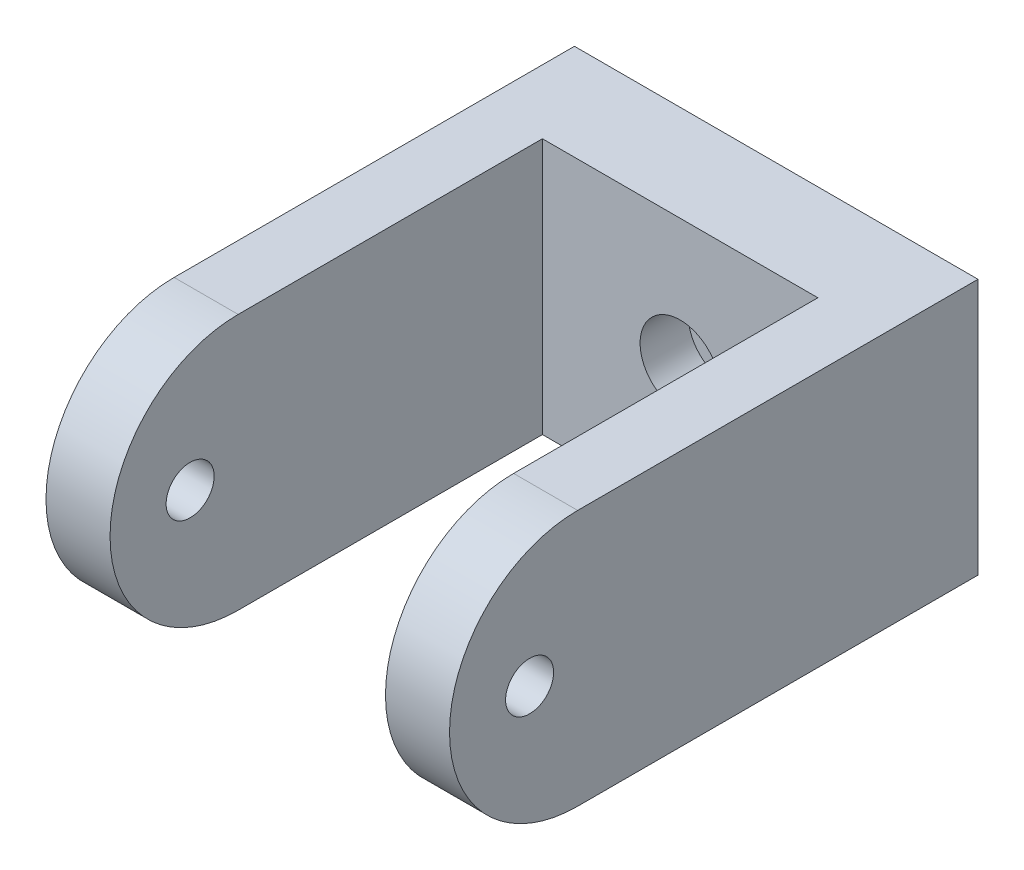
from build123d import *

# Parameters (mm, degrees)
IZIM1_W                     = 25.2
IZIM1_H                     = 16
Y_KSEKLIK_EKSTR_ZYON1_DEPTH = 3
IZIM3_W                     = 4
IZIM3_H                     = 16
Y_KSEKLIK_EKSTR_ZYON2_DEPTH = 30
KES_EKSTR_ZYON3_DEPTH       = 30
IZIM5_R                     = 1.5
KES_EKSTR_ZYON4_DEPTH       = 30
IZIM6_R                     = 2.5
KES_EKSTR_ZYON5_DEPTH       = 4
IZIM7_R                     = 1
KES_EKSTR_ZYON6_DEPTH       = 15


with BuildPart() as part:
    # Çizim1 → Yükseklik-Ekstrüzyon1 (new, symmetric)
    with BuildSketch(Plane.XY):
        with Locations((8.796736324, -6.511156057)):
            Rectangle(IZIM1_W, IZIM1_H)
    extrude(amount=Y_KSEKLIK_EKSTR_ZYON1_DEPTH, both=True)

    # Çizim3 → Yükseklik-Ekstrüzyon2 (add)
    with BuildSketch(Plane.XY):
        with Locations((-1.803263676, -6.511156057)):
            Rectangle(IZIM3_W, IZIM3_H)
        with Locations((19.396736324, -6.511156057)):
            Rectangle(IZIM3_W, IZIM3_H)
    extrude(amount=Y_KSEKLIK_EKSTR_ZYON2_DEPTH)

    # Çizim4 → Kes-Ekstrüzyon3 (cut, symmetric)
    with BuildSketch(Plane(origin=(0, 0, 0), x_dir=(0, 0, -1), z_dir=(1, 0, 0))):
        with BuildLine():
            Line((-22, 1.488843943), (-31.468609906, 1.488843943))
            Line((-31.468609906, 1.488843943), (-31.468609906, -14.511156057))
            Line((-31.468609906, -14.511156057), (-22, -14.511156057))
            ThreePointArc((-22, -14.511156057), (-30, -6.511156057), (-22, 1.488843943))
        make_face()
    extrude(amount=KES_EKSTR_ZYON3_DEPTH, both=True, mode=Mode.SUBTRACT)

    # Çizim5 → Kes-Ekstrüzyon4 (cut, symmetric)
    with BuildSketch(Plane(origin=(0, 0, 0), x_dir=(0, 0, -1), z_dir=(1, 0, 0))):
        with Locations(Location((-25, -6.511156057, 0), (0, 0, 90))):
            Circle(IZIM5_R)
    extrude(amount=KES_EKSTR_ZYON4_DEPTH, both=True, mode=Mode.SUBTRACT)

    # Çizim6 → Kes-Ekstrüzyon5 (cut)
    with BuildSketch(Plane.XY):
        with Locations((8.796736324, -6.511156057)):
            Circle(IZIM6_R)
    extrude(amount=KES_EKSTR_ZYON5_DEPTH, mode=Mode.SUBTRACT)

    # Çizim7 → Kes-Ekstrüzyon6 (cut)
    with BuildSketch(Plane.XY):
        with Locations((8.796736324, -6.511156057)):
            Circle(IZIM7_R)
    extrude(amount=-KES_EKSTR_ZYON6_DEPTH, mode=Mode.SUBTRACT)


solid = part.part
